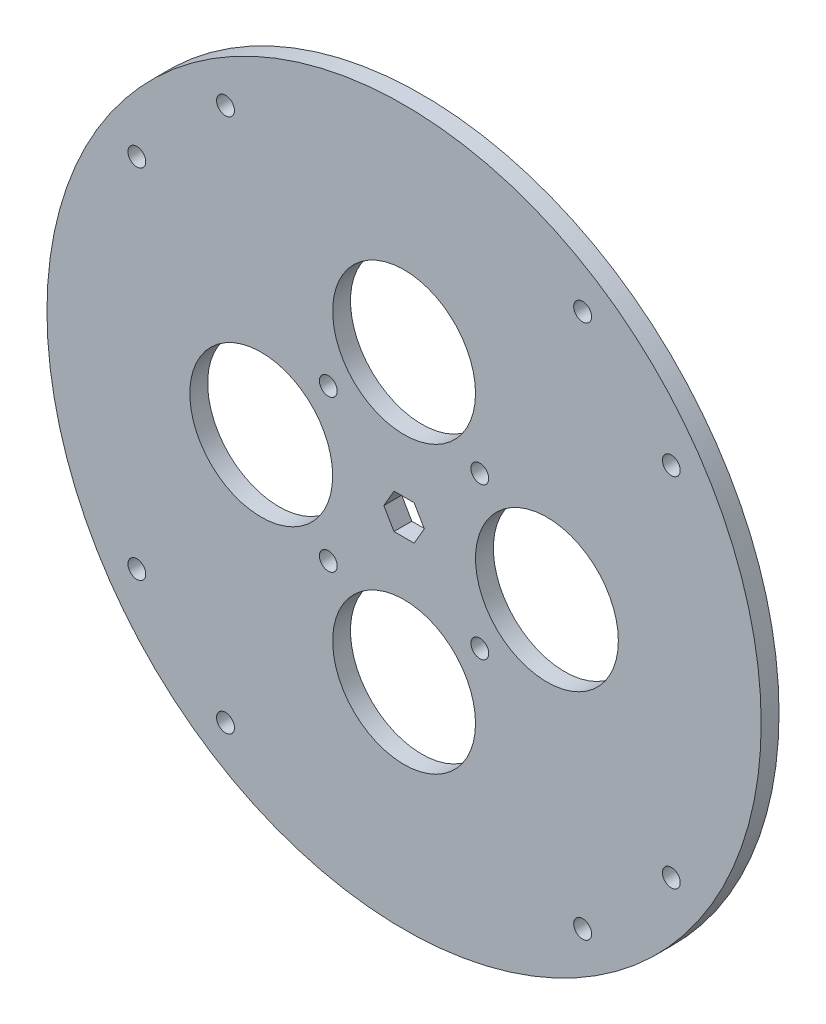
from build123d import *

# Parameters (mm, degrees)
SKETCH1_R           = 127
SKETCH1_R_2         = 25.4
BOSS_EXTRUDE1_DEPTH = 6.35
SKETCH3_R           = 3.175
CUT_EXTRUDE1_DEPTH  = 6.35


with BuildPart() as part:
    # Sketch1 → Boss-Extrude1 (new body)
    with BuildSketch(Plane.XY):
        Circle(SKETCH1_R)
        with Locations((0, 50.8)):
            Circle(SKETCH1_R_2, mode=Mode.SUBTRACT)
        with Locations((50.8, 0)):
            Circle(SKETCH1_R_2, mode=Mode.SUBTRACT)
        with Locations((0, -50.8)):
            Circle(SKETCH1_R_2, mode=Mode.SUBTRACT)
        with Locations((-50.8, 0)):
            Circle(SKETCH1_R_2, mode=Mode.SUBTRACT)
        Polygon((7.18570145, 0), (3.592850725, 6.223), (-3.592850725, 6.223), (-7.18570145, 0), (-3.592850725, -6.223), (3.592850725, -6.223), align=None, mode=Mode.SUBTRACT)
    extrude(amount=BOSS_EXTRUDE1_DEPTH)

    # Sketch3 → Cut-Extrude1 (cut)
    with BuildSketch(Plane(origin=(0, 0, 0), x_dir=(-1, 0, 0), z_dir=(0, 0, -1))):
        with Locations((-26.940768363, 26.940768363)):
            Circle(SKETCH3_R)
        with Locations((26.940768363, 26.940768363)):
            Circle(SKETCH3_R)
        with Locations((26.940768363, -26.940768363)):
            Circle(SKETCH3_R)
        with Locations((-26.940768363, -26.940768363)):
            Circle(SKETCH3_R)
        with Locations((-63.5, 95.038097624)):
            Circle(SKETCH3_R)
        with Locations((63.5, 95.038097624)):
            Circle(SKETCH3_R)
        with Locations((95.038097624, 63.5)):
            Circle(SKETCH3_R)
        with Locations((95.038097624, -63.5)):
            Circle(SKETCH3_R)
        with Locations((63.5, -95.038097624)):
            Circle(SKETCH3_R)
        with Locations((-63.5, -95.038097624)):
            Circle(SKETCH3_R)
        with Locations((-95.038097624, -63.5)):
            Circle(SKETCH3_R)
        with Locations((-95.038097624, 63.5)):
            Circle(SKETCH3_R)
    extrude(amount=-CUT_EXTRUDE1_DEPTH, mode=Mode.SUBTRACT)


solid = part.part
